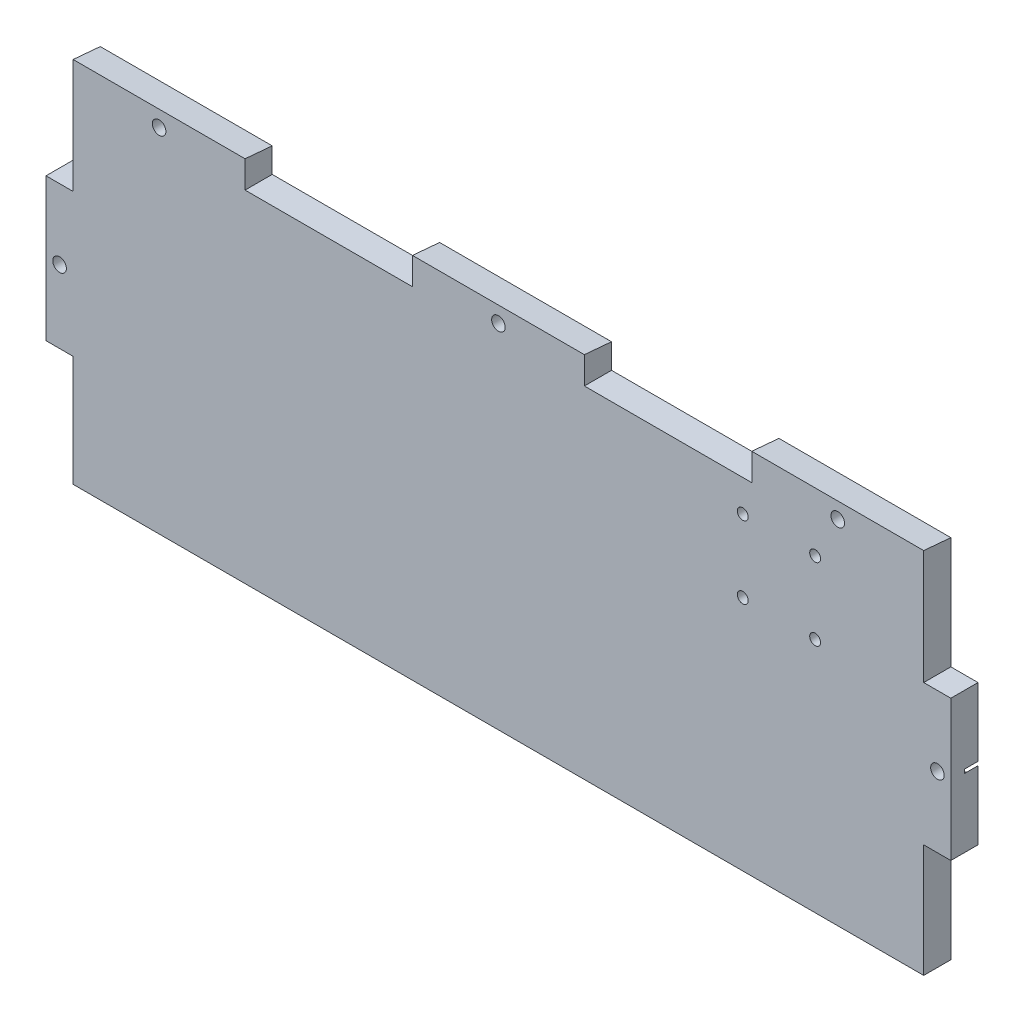
from build123d import *

# Parameters (mm, degrees)
ESQUISSE1_W                  = 188
ESQUISSE1_H                  = 81.33
BOSS_EXTRU_1_DEPTH           = 6
ENL_V_MAT_EXTRU_2_DEPTH      = 205.925764364
ENL_V_MAT_EXTRU_2_DEPTH_BACK = 205.925764364
ESQUISSE4_W                  = 6
ESQUISSE4_H                  = 31.567534009
BOSS_EXTRU_2_DEPTH           = 6
ESQUISSE5_W                  = 6
ESQUISSE5_H                  = 31.067534009
BOSS_EXTRU_3_DEPTH           = 6
ESQUISSE6_W                  = 37
ESQUISSE6_H                  = 6
ENL_V_MAT_EXTRU_3_DEPTH      = 6
ESQUISSE7_R                  = 2.995
ENL_V_MAT_EXTRU_4_DEPTH      = 3
ESQUISSE8_R                  = 1.5
ENL_V_MAT_EXTRU_5_DEPTH      = 6
ESQUISSE9_R                  = 1.2
ENL_V_MAT_EXTRU_6_DEPTH      = 10


with BuildPart() as part:
    # Esquisse1 → Boss.-Extru.1 (new body)
    with BuildSketch(Plane.XY):
        with Locations((-94, 40.665)):
            Rectangle(ESQUISSE1_W, ESQUISSE1_H)
    extrude(amount=BOSS_EXTRU_1_DEPTH)

    # Esquisse2 → Enlèv. mat.-Extru.2 (cut, two sides: drawn at the far end of the back side and taken through both)
    with BuildSketch(Plane.ZY.offset(188).offset(-ENL_V_MAT_EXTRU_2_DEPTH_BACK)):
        Polygon((178.443334928, 96.416836907), (6, 81.33), (0, 80.805068019), (-172.443334928, 65.718231112), (-202.617008742, 410.604900969), (148.269661115, 441.303506764), align=None)
    extrude(amount=ENL_V_MAT_EXTRU_2_DEPTH + ENL_V_MAT_EXTRU_2_DEPTH_BACK, mode=Mode.SUBTRACT)

    # Esquisse4 → Boss.-Extru.2 (add)
    with BuildSketch(Plane.ZY.offset(188)):
        with Locations((3, 40.283767005)):
            Rectangle(ESQUISSE4_W, ESQUISSE4_H)
    extrude(amount=BOSS_EXTRU_2_DEPTH)

    # Esquisse5 → Boss.-Extru.3 (add)
    with BuildSketch(Plane(origin=(0, 0, 0), x_dir=(0, 0, -1), z_dir=(1, 0, 0))):
        with Locations((-3, 40.533767005)):
            Rectangle(ESQUISSE5_W, ESQUISSE5_H)
    extrude(amount=BOSS_EXTRU_3_DEPTH)

    # Esquisse6 → Enlèv. mat.-Extru.3 (cut)
    with BuildSketch(Plane.XY.offset(6)):
        with Locations((-131.5, 78.33)):
            Rectangle(ESQUISSE6_W, ESQUISSE6_H)
        with Locations((-56.5, 78.33)):
            Rectangle(ESQUISSE6_W, ESQUISSE6_H)
    extrude(amount=-ENL_V_MAT_EXTRU_3_DEPTH, mode=Mode.SUBTRACT)

    # Esquisse7 → Enlèv. mat.-Extru.4 (cut)
    with BuildSketch(Plane(origin=(0, 0, 0), x_dir=(-1, 0, 0), z_dir=(0, 0, -1))):
        with Locations((94, 77.805068019)):
            Circle(ESQUISSE7_R)
        with Locations((19, 77.805068019)):
            Circle(ESQUISSE7_R)
        with Locations((169, 77.805068019)):
            Circle(ESQUISSE7_R)
        with Locations((191, 40.567534009)):
            Circle(ESQUISSE7_R)
        with Locations((-3.034014412, 40.567534009)):
            Circle(ESQUISSE7_R)
    extrude(amount=-ENL_V_MAT_EXTRU_4_DEPTH, mode=Mode.SUBTRACT)

    # Esquisse8 → Enlèv. mat.-Extru.5 (cut)
    with BuildSketch(Plane(origin=(0, 0, 0), x_dir=(-1, 0, 0), z_dir=(0, 0, -1))):
        with Locations((-3.034014412, 40.567534009)):
            Circle(ESQUISSE8_R)
        with Locations((19, 77.805068019)):
            Circle(ESQUISSE8_R)
        with Locations((94, 77.805068019)):
            Circle(ESQUISSE8_R)
        with Locations((169, 77.805068019)):
            Circle(ESQUISSE8_R)
        with Locations((191, 40.567534009)):
            Circle(ESQUISSE8_R)
    extrude(amount=-ENL_V_MAT_EXTRU_5_DEPTH, mode=Mode.SUBTRACT)

    # Esquisse9 → Enlèv. mat.-Extru.6 (cut)
    with BuildSketch(Plane.XY.offset(6)):
        with Locations((-24, 68.33)):
            Circle(ESQUISSE9_R)
        with Locations((-24, 52.33)):
            Circle(ESQUISSE9_R)
        with Locations((-40, 68.33)):
            Circle(ESQUISSE9_R)
        with Locations((-40, 52.33)):
            Circle(ESQUISSE9_R)
    extrude(amount=-ENL_V_MAT_EXTRU_6_DEPTH, mode=Mode.SUBTRACT)


solid = part.part
